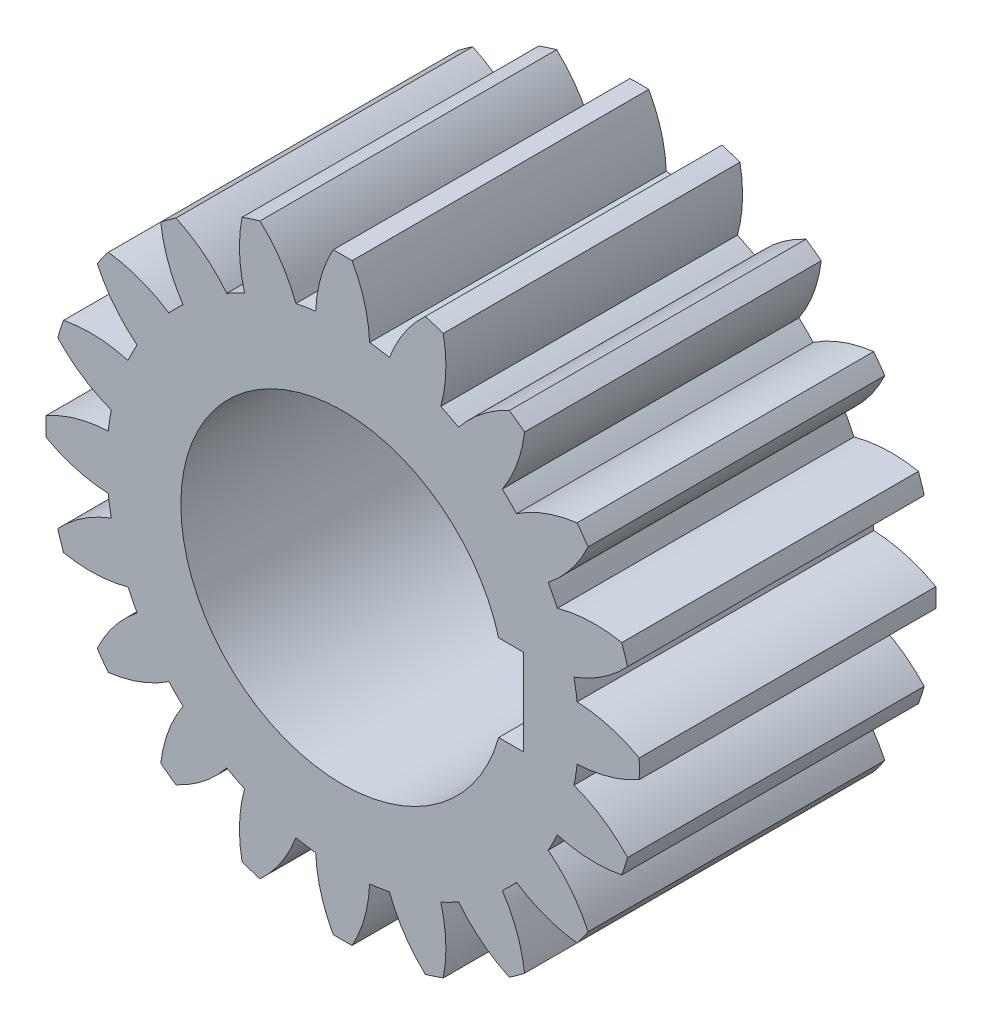
from build123d import *

# Parameters (mm, degrees)
SKETCH_1_R               = 87.5
EXTRUDE_1_DEPTH          = 55
EXTRUDE_2_DEPTH          = 55
PATTERN_CIRCULAR_1_COUNT = 20
CUT_EXTRUDE_1_DEPTH      = 191.525588833


with BuildPart() as part:
    # 草图1 → 拉伸1 (new, symmetric)
    with BuildSketch(Plane.XY):
        Circle(SKETCH_1_R)
    extrude(amount=EXTRUDE_1_DEPTH, both=True)

    # 草图2 → 拉伸2 (add, symmetric)
    with BuildSketch(Plane.XY):
        with BuildLine():
            ThreePointArc((10, 86.926693254), (0, 87.5), (-10, 86.926693254))
            ThreePointArc((-10, 86.926693254), (-8.101258535, 98.817083904), (-3.5, 109.944304082))
            ThreePointArc((-3.5, 109.944304082), (0, 110), (3.5, 109.944304082))
            ThreePointArc((3.5, 109.944304082), (8.101258535, 98.817083904), (10, 86.926693254))
        make_face()
    extrude_2 = extrude(amount=EXTRUDE_2_DEPTH, both=True)

    # 阵列(圆周)1: 拉伸2 ×20 about axis
    pattern_circular_1_axis = Axis((0, 0, 0), (0, 0, 1))
    for i in range(1, PATTERN_CIRCULAR_1_COUNT):
        add(extrude_2.rotate(pattern_circular_1_axis, i * 360 / PATTERN_CIRCULAR_1_COUNT))

    # 草图3 → 切除-拉伸1 (cut, through all)
    with BuildSketch(Plane.XY.offset(-55)):
        with BuildLine():
            Line((57.827329179, 16), (67, 16))
            Line((67, 16), (67, -16))
            Line((67, -16), (57.827329179, -16))
            ThreePointArc((57.827329179, -16), (-60, 0), (57.827329179, 16))
        make_face()
    extrude(amount=CUT_EXTRUDE_1_DEPTH, mode=Mode.SUBTRACT)


solid = part.part
